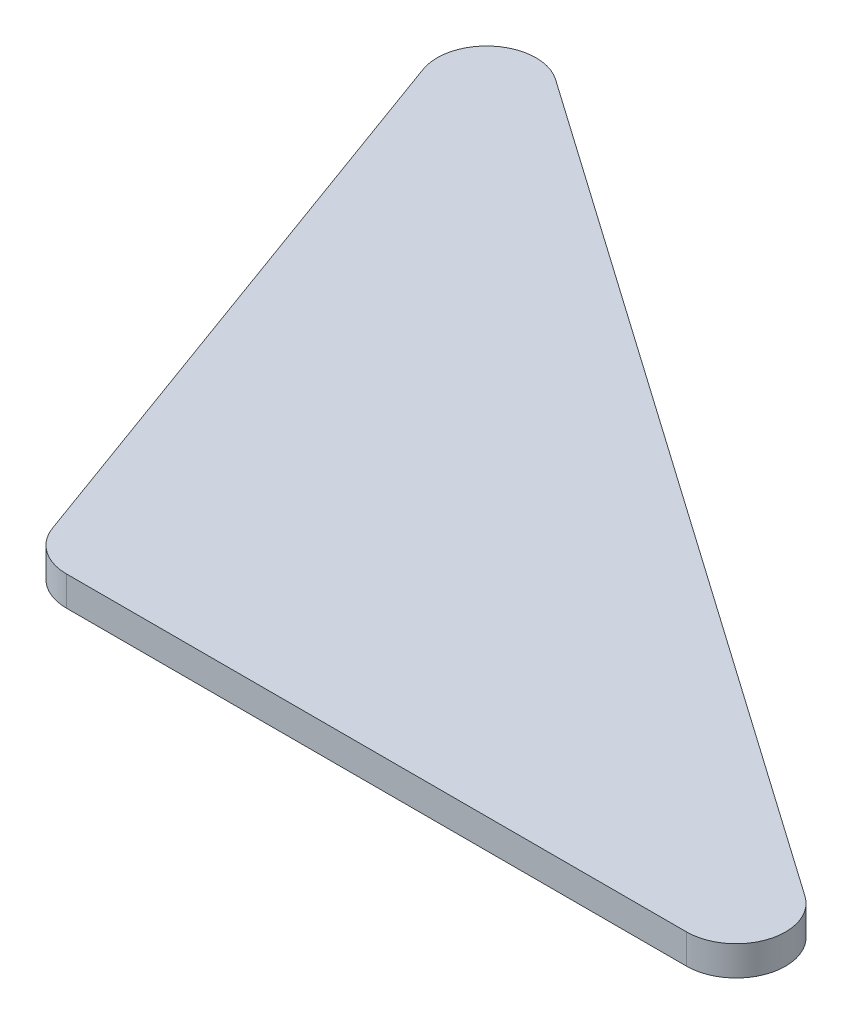
from build123d import *

# Parameters (mm, degrees)
BOSS_EXTRUDE1_DEPTH = 3
FILLET1_R           = 5


with BuildPart() as part:
    # Sketch1 → Boss-Extrude1 (new body)
    with BuildSketch(Plane(origin=(0, 0, 0), x_dir=(1, 0, 0), z_dir=(0, 1, 0))):
        Polygon((0, 0), (82, 0), (-28.045651753, 77.054794904), align=None)
    extrude(amount=BOSS_EXTRUDE1_DEPTH)

    # Fillet1
    fillet1_edges = [part.edges().sort_by_distance(p)[0] for p in [
        (-28.045651753, 1.5, -77.054794904),
        (82, 1.5, 0),
        (0, 1.5, 0),
    ]]
    fillet(fillet1_edges, radius=FILLET1_R)


solid = part.part
